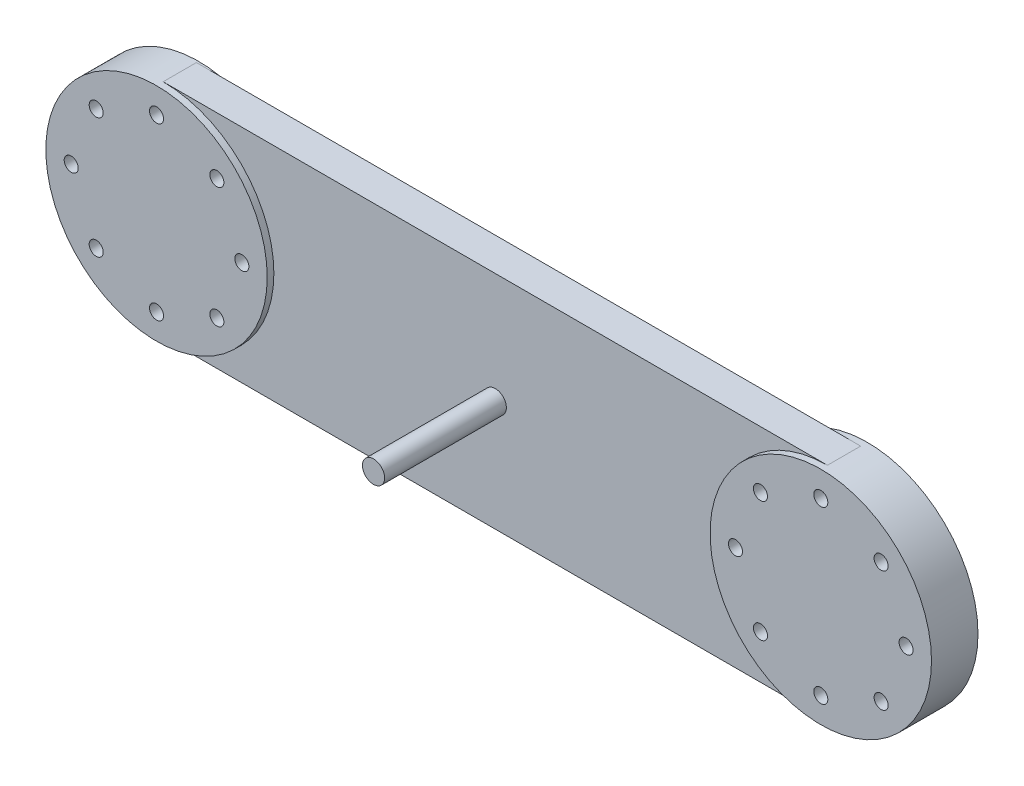
from build123d import *

# Parameters (mm, degrees)
SKETCH_1_R               = 50
EXTRUDE_18_DEPTH         = 13
EXTRUDE_18_2_DEPTH       = 13
SKETCH_1_28_W            = 300
SKETCH_1_28_H            = 100
EXTRUDE_21_DEPTH         = 15
SKETCH_1_30_R            = 5
EXTRUDE_22_DEPTH         = 70
SKETCH_1_31_R            = 50
CUT_EXTRUDE_2_DEPTH      = 41
EXTRUDE_23_DEPTH         = 18
EXTRUDE_23_DEPTH_BACK    = 1
SKETCH_1_32_R            = 50
CUT_EXTRUDE_5_DEPTH      = 130
CUT_EXTRUDE_5_DEPTH_BACK = 69
SKETCH_1_35_R            = 3.175
SKETCH_1_36_R            = 50
CUT_EXTRUDE_6_DEPTH      = 34
EXTRUDE_24_DEPTH         = 18
EXTRUDE_24_DEPTH_BACK    = 3
SKETCH_1_37_R            = 50
CUT_EXTRUDE_7_DEPTH      = 87
CUT_EXTRUDE_7_DEPTH_BACK = 98
SKETCH_1_41_R            = 3.175


with BuildPart() as part:
    # 草图1 → 凸台-拉伸18 (new body)
    with BuildSketch(Plane.XY):
        with Locations((0, 50)):
            Circle(SKETCH_1_R)
    extrude(amount=EXTRUDE_18_DEPTH)



with BuildPart() as body_2:
    # 草图1 → Extrude 18 2 (new body)
    with BuildSketch(Plane.XY):
        with Locations((-300, 50)):
            Circle(SKETCH_1_R)
    extrude(amount=EXTRUDE_18_2_DEPTH)


with BuildPart() as part_1:
    add(part.part)

    add(body_2.part)  # 凸台-拉伸21 merges body 2
    # 草图1<28> → 凸台-拉伸21 (add)
    with BuildSketch(Plane.XY):
        with Locations((-150, 50)):
            Rectangle(SKETCH_1_28_W, SKETCH_1_28_H)
    extrude(amount=EXTRUDE_21_DEPTH)

    # 草图1<30> → 凸台-拉伸22 (add)
    with BuildSketch(Plane.XY):
        with Locations((-150, 50)):
            Circle(SKETCH_1_30_R)
    extrude(amount=EXTRUDE_22_DEPTH)

    # 草图1<31> → 切除-拉伸2 (cut)
    with BuildSketch(Plane.XY):
        with Locations((-300, 50)):
            Circle(SKETCH_1_31_R)
    extrude(amount=CUT_EXTRUDE_2_DEPTH, mode=Mode.SUBTRACT)

    # 草图1<32> → 凸台-拉伸23 (add, two sides: drawn at the far end of the back side and taken through both)
    with BuildSketch(Plane.XY.offset(-EXTRUDE_23_DEPTH_BACK)):
        with Locations((-300, 50)):
            Circle(SKETCH_1_32_R)
    extrude(amount=EXTRUDE_23_DEPTH + EXTRUDE_23_DEPTH_BACK)

    # 草图1<35> → 切除-拉伸5 (cut, two sides: drawn at the far end of the back side and taken through both)
    with BuildSketch(Plane.XY.offset(-CUT_EXTRUDE_5_DEPTH_BACK)):
        with Locations((-261.469660941, 50)):
            Circle(SKETCH_1_35_R)
    extrude(amount=CUT_EXTRUDE_5_DEPTH + CUT_EXTRUDE_5_DEPTH_BACK, mode=Mode.SUBTRACT)

    # 草图1<36> → 切除-拉伸6 (cut)
    with BuildSketch(Plane.XY):
        with Locations((0, 50)):
            Circle(SKETCH_1_36_R)
    extrude(amount=CUT_EXTRUDE_6_DEPTH, mode=Mode.SUBTRACT)

    # 草图1<37> → 凸台-拉伸24 (add, two sides: drawn at the far end of the back side and taken through both)
    with BuildSketch(Plane.XY.offset(-EXTRUDE_24_DEPTH_BACK)):
        with Locations((0, 50)):
            Circle(SKETCH_1_37_R)
    extrude(amount=EXTRUDE_24_DEPTH + EXTRUDE_24_DEPTH_BACK)

    # 草图1<41> → 切除-拉伸7 (cut, two sides: drawn at the far end of the back side and taken through both)
    with BuildSketch(Plane.XY.offset(-CUT_EXTRUDE_7_DEPTH_BACK)):
        with Locations((0, 11.469660941)):
            Circle(SKETCH_1_41_R)
        with Locations((0, 88.530339059)):
            Circle(SKETCH_1_41_R)
        with Locations((-300, 11.469660941)):
            Circle(SKETCH_1_41_R)
        with Locations((-300, 88.530339059)):
            Circle(SKETCH_1_41_R)
        with Locations((-327.24506403, 22.75493597)):
            Circle(SKETCH_1_41_R)
        with Locations((-261.469660941, 50)):
            Circle(SKETCH_1_41_R)
        with Locations((-38.530339059, 50)):
            Circle(SKETCH_1_41_R)
        with Locations((-272.75493597, 22.75493597)):
            Circle(SKETCH_1_41_R)
        with Locations((-338.530339059, 50)):
            Circle(SKETCH_1_41_R)
        with Locations((-327.24506403, 77.24506403)):
            Circle(SKETCH_1_41_R)
        with Locations((-272.75493597, 77.24506403)):
            Circle(SKETCH_1_41_R)
        with Locations((-27.24506403, 77.24506403)):
            Circle(SKETCH_1_41_R)
        with Locations((27.24506403, 77.24506403)):
            Circle(SKETCH_1_41_R)
        with Locations((38.530339059, 50)):
            Circle(SKETCH_1_41_R)
        with Locations((27.24506403, 22.75493597)):
            Circle(SKETCH_1_41_R)
        with Locations((-27.24506403, 22.75493597)):
            Circle(SKETCH_1_41_R)
    extrude(amount=CUT_EXTRUDE_7_DEPTH + CUT_EXTRUDE_7_DEPTH_BACK, mode=Mode.SUBTRACT)


solid = part_1.part
